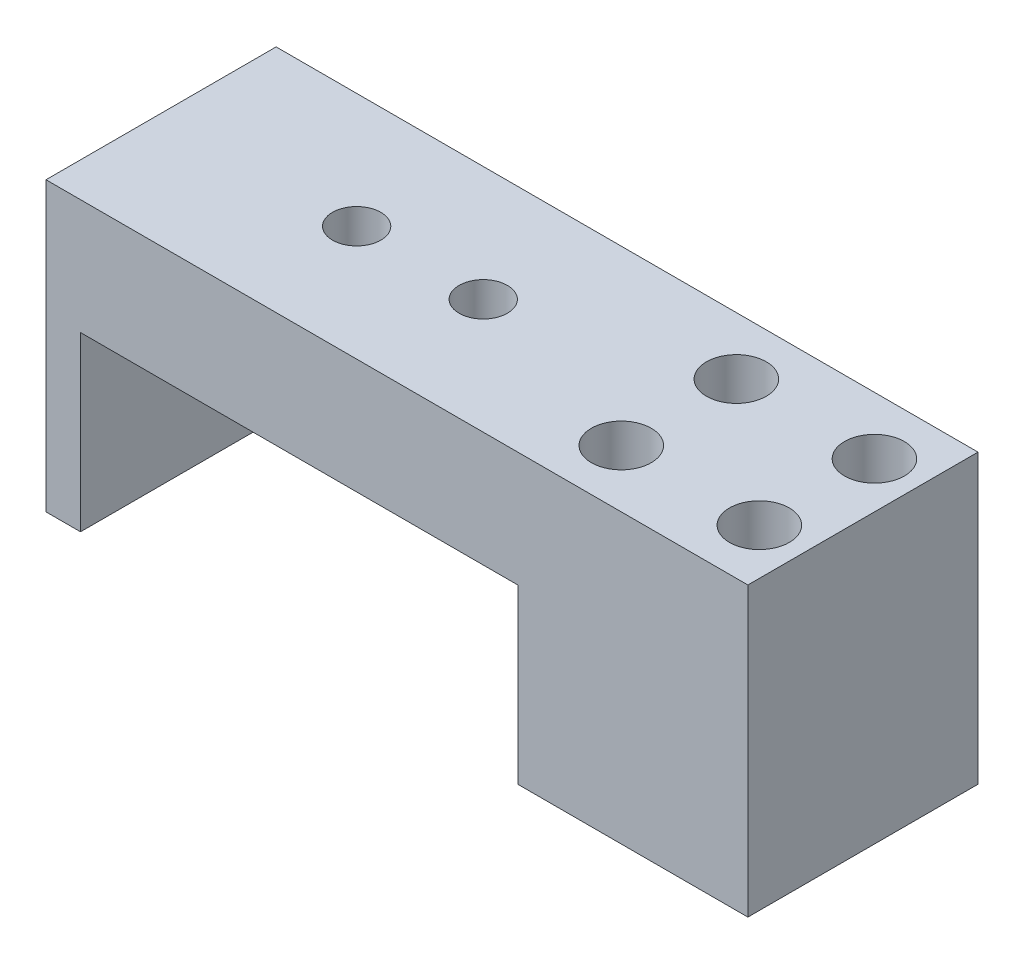
from build123d import *

# Parameters (mm, degrees)
SKETCH_1_W          = 20
SKETCH_1_H          = 20
SKETCH_1_R          = 2.6
EXTRUDE_1_DEPTH     = 25
SKETCH_2_W          = 41
SKETCH_2_H          = 20
EXTRUDE_2_DEPTH     = 10
SKETCH_3_W          = 3
SKETCH_3_H          = 20
EXTRUDE_3_DEPTH     = 15
SKETCH_4_R          = 2.1
CUT_EXTRUDE_1_DEPTH = 58.671483421


with BuildPart() as part:
    # 草图1 → 凸台-拉伸1 (new body)
    with BuildSketch(Plane(origin=(0, 0, 0), x_dir=(1, 0, 0), z_dir=(0, 1, 0))):
        Rectangle(SKETCH_1_W, SKETCH_1_H)
        with Locations(Location((-6, 5, 0), (0, 0, 270))):
            Circle(SKETCH_1_R, mode=Mode.SUBTRACT)
        with Locations(Location((6, 5, 0), (0, 0, 270))):
            Circle(SKETCH_1_R, mode=Mode.SUBTRACT)
        with Locations(Location((-6, -5, 0), (0, 0, 270))):
            Circle(SKETCH_1_R, mode=Mode.SUBTRACT)
        with Locations(Location((6, -5, 0), (0, 0, 270))):
            Circle(SKETCH_1_R, mode=Mode.SUBTRACT)
    extrude(amount=EXTRUDE_1_DEPTH)

    # 草图2 → 凸台-拉伸2 (add)
    with BuildSketch(Plane(origin=(0, 25, 0), x_dir=(1, 0, 0), z_dir=(0, 1, 0))):
        with Locations((-30.5, 0)):
            Rectangle(SKETCH_2_W, SKETCH_2_H)
    extrude(amount=-EXTRUDE_2_DEPTH)

    # 草图3 → 凸台-拉伸3 (add)
    with BuildSketch(Plane.XZ.offset(-15)):
        with Locations((-49.5, 0)):
            Rectangle(SKETCH_3_W, SKETCH_3_H)
    extrude(amount=EXTRUDE_3_DEPTH)

    # 草图4 → 切除-拉伸1 (cut, through all)
    with BuildSketch(Plane(origin=(0, 25, 0), x_dir=(1, 0, 0), z_dir=(0, 1, 0))):
        with Locations(Location((-34, 0, 0), (0, 0, 270))):
            Circle(SKETCH_4_R)
        with Locations(Location((-23, 0, 0), (0, 0, 270))):
            Circle(SKETCH_4_R)
    extrude(amount=-CUT_EXTRUDE_1_DEPTH, mode=Mode.SUBTRACT)


solid = part.part
